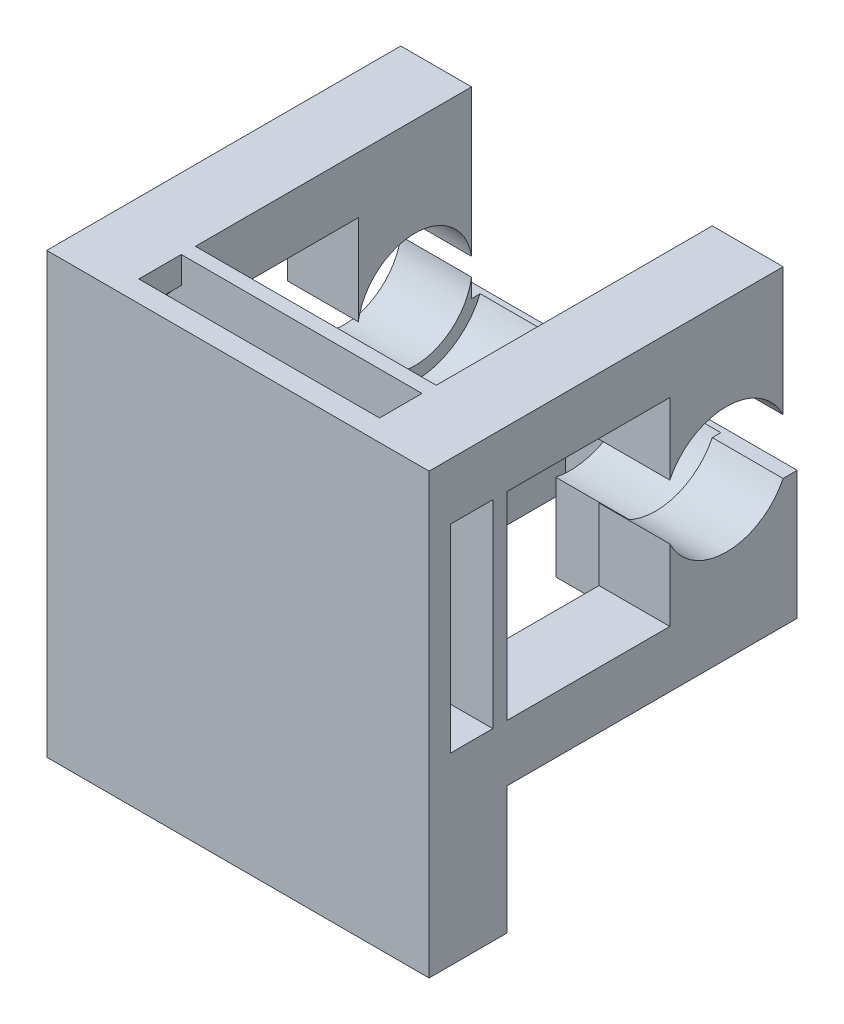
from build123d import *

# Parameters (mm, degrees)
SKETCH1_W           = 68.58
SKETCH1_H           = 55.88
BOSS_EXTRUDE1_DEPTH = 3.81
SKETCH2_W           = 12.7
SKETCH2_H           = 10.16
BOSS_EXTRUDE2_DEPTH = 59.69
SKETCH6_W           = 12.7
SKETCH6_H           = 20.32
BOSS_EXTRUDE3_DEPTH = 35.56
CUT_EXTRUDE1_REACH  = 108.718
SKETCH4_R           = 11.303
SKETCH7_W           = 68.58
SKETCH7_H           = 55.88
SKETCH7_W_2         = 43.18
SKETCH7_H_2         = 22.86
BOSS_EXTRUDE4_DEPTH = 2.54
SKETCH8_R           = 3.429
SKETCH8_R_2         = 7.493
CUT_EXTRUDE2_DEPTH  = 2.54
SKETCH9_W           = 68.58
SKETCH9_H           = 22.987
BOSS_EXTRUDE5_DEPTH = 2.54
CUT_EXTRUDE3_REACH  = 110.159
SKETCH10_W          = 12.446
SKETCH10_H          = 3.048
SKETCH11_W          = 15.367
SKETCH11_H          = 22.987
BOSS_EXTRUDE6_DEPTH = 12.7
BOSS_EXTRUDE7_DEPTH = 22.86
CUT_EXTRUDE5_START  = -43.18
SKETCH14_R          = 12.7
CUT_EXTRUDE5_DEPTH  = 43.18
CUT_EXTRUDE6_REACH  = 102.587
SKETCH13_R          = 10.287
SKETCH15_R          = 31.640904619
CUT_EXTRUDE7_DEPTH  = 7.62


with BuildPart() as part:
    # Sketch1 → Boss-Extrude1 (new body)
    with BuildSketch(Plane.XY):
        with Locations((34.29, 27.94)):
            Rectangle(SKETCH1_W, SKETCH1_H)
    extrude(amount=BOSS_EXTRUDE1_DEPTH)

    # Sketch2 → Boss-Extrude2 (add)
    with BuildSketch(Plane(origin=(0, 0, 0), x_dir=(-1, 0, 0), z_dir=(0, 0, -1))):
        with Locations((-6.35, 50.8)):
            Rectangle(SKETCH2_W, SKETCH2_H)
        with Locations((-62.23, 50.8)):
            Rectangle(SKETCH2_W, SKETCH2_H)
        with Locations((-6.35, 5.08)):
            Rectangle(SKETCH2_W, SKETCH2_H)
        with Locations((-62.23, 5.08)):
            Rectangle(SKETCH2_W, SKETCH2_H)
    extrude(amount=BOSS_EXTRUDE2_DEPTH)

    # Sketch6 → Boss-Extrude3 (add)
    with BuildSketch(Plane(origin=(0, 10.16, 0), x_dir=(1, 0, 0), z_dir=(0, 1, 0))):
        with Locations((62.23, 49.53)):
            Rectangle(SKETCH6_W, SKETCH6_H)
        with Locations((6.35, 49.53)):
            Rectangle(SKETCH6_W, SKETCH6_H)
    extrude(amount=BOSS_EXTRUDE3_DEPTH)

    # Sketch4 → Cut-Extrude1 (cut, up to next)
    with BuildSketch(Plane(origin=(68.58, 0, 0), x_dir=(0, 0, -1), z_dir=(1, 0, 0)), mode=Mode.PRIVATE) as cut_extrude1_sk1:
        with Locations((49.53, 27.94)):
            Circle(SKETCH4_R)
    cut_extrude1_tool1 = extrude(cut_extrude1_sk1.sketch, amount=-CUT_EXTRUDE1_REACH, mode=Mode.PRIVATE) & part.part
    add(cut_extrude1_tool1.solids().sort_by_distance((68.58, 27.94, -49.53))[0], mode=Mode.SUBTRACT)

    # Sketch7 → Boss-Extrude4 (add)
    with BuildSketch(Plane(origin=(0, 0, -7.62), x_dir=(-1, 0, 0), z_dir=(0, 0, -1))):
        with Locations((-34.29, 27.94)):
            Rectangle(SKETCH7_W, SKETCH7_H)
        with Locations((-34.29, -11.43)):
            Rectangle(SKETCH7_W_2, SKETCH7_H_2)
    extrude(amount=BOSS_EXTRUDE4_DEPTH)

    # Sketch8 → Cut-Extrude2 (cut)
    with BuildSketch(Plane(origin=(0, 0, -10.16), x_dir=(-1, 0, 0), z_dir=(0, 0, -1))):
        with Locations((-34.29, -10.16)):
            Circle(SKETCH8_R)
        with Locations((-34.29, 27.94)):
            Circle(SKETCH8_R_2)
    extrude(amount=-CUT_EXTRUDE2_DEPTH, mode=Mode.SUBTRACT)

    # Sketch9 → Boss-Extrude5 (add)
    with BuildSketch(Plane(origin=(0, 0, -59.69), x_dir=(-1, 0, 0), z_dir=(0, 0, -1))):
        with Locations((-34.29, 11.4935)):
            Rectangle(SKETCH9_W, SKETCH9_H)
    extrude(amount=BOSS_EXTRUDE5_DEPTH)

    # Sketch10 → Cut-Extrude3 (cut, up to next)
    with BuildSketch(Plane.XZ, mode=Mode.PRIVATE) as cut_extrude3_sk1:
        with Locations((34.29, -59.69)):
            Rectangle(SKETCH10_W, SKETCH10_H)
    cut_extrude3_tool1 = extrude(cut_extrude3_sk1.sketch, amount=-CUT_EXTRUDE3_REACH, mode=Mode.PRIVATE) & part.part
    add(cut_extrude3_tool1.solids().sort_by_distance((34.29, 0, -59.69))[0], mode=Mode.SUBTRACT)

    # Sketch11 → Boss-Extrude6 (add)
    with BuildSketch(Plane.XY.offset(-59.69)):
        with Locations((20.3835, 11.4935)):
            Rectangle(SKETCH11_W, SKETCH11_H)
        with Locations((48.1965, 11.4935)):
            Rectangle(SKETCH11_W, SKETCH11_H)
    extrude(amount=BOSS_EXTRUDE6_DEPTH)

    # Sketch12 → Boss-Extrude7 (add)
    with BuildSketch(Plane.XZ):
        Polygon((12.7, -10.16), (0, -10.16), (0, 3.81), (68.58, 3.81), (68.58, -10.16), (55.88, -10.16), (55.88, 0), (12.7, 0), align=None)
    extrude(amount=BOSS_EXTRUDE7_DEPTH)

    # Sketch14 → Cut-Extrude5 (cut)
    with BuildSketch(Plane(origin=(55.88, 0, 0), x_dir=(0, 0, -1), z_dir=(1, 0, 0)).offset(CUT_EXTRUDE5_START)):
        with Locations((49.53, 27.94)):
            Circle(SKETCH14_R)
    extrude(amount=CUT_EXTRUDE5_DEPTH, mode=Mode.SUBTRACT)

    # Sketch13 → Cut-Extrude6 (cut, up to next)
    with BuildSketch(Plane(origin=(12.7, 0, 0), x_dir=(0, 0, -1), z_dir=(1, 0, 0)), mode=Mode.PRIVATE) as cut_extrude6_sk1:
        with Locations((49.53, 27.94)):
            Circle(SKETCH13_R)
    cut_extrude6_tool1 = extrude(cut_extrude6_sk1.sketch, amount=-CUT_EXTRUDE6_REACH, mode=Mode.PRIVATE) & part.part
    add(cut_extrude6_tool1.solids().sort_by_distance((12.7, 27.94, -49.53))[0], mode=Mode.SUBTRACT)

    # Sketch15 → Cut-Extrude7 (cut)
    with BuildSketch(Plane(origin=(0, 0, 0), x_dir=(-1, 0, 0), z_dir=(0, 0, -1))):
        with Locations((-34.29, 27.94)):
            Circle(SKETCH15_R)
    extrude(amount=CUT_EXTRUDE7_DEPTH, mode=Mode.SUBTRACT)


solid = part.part
